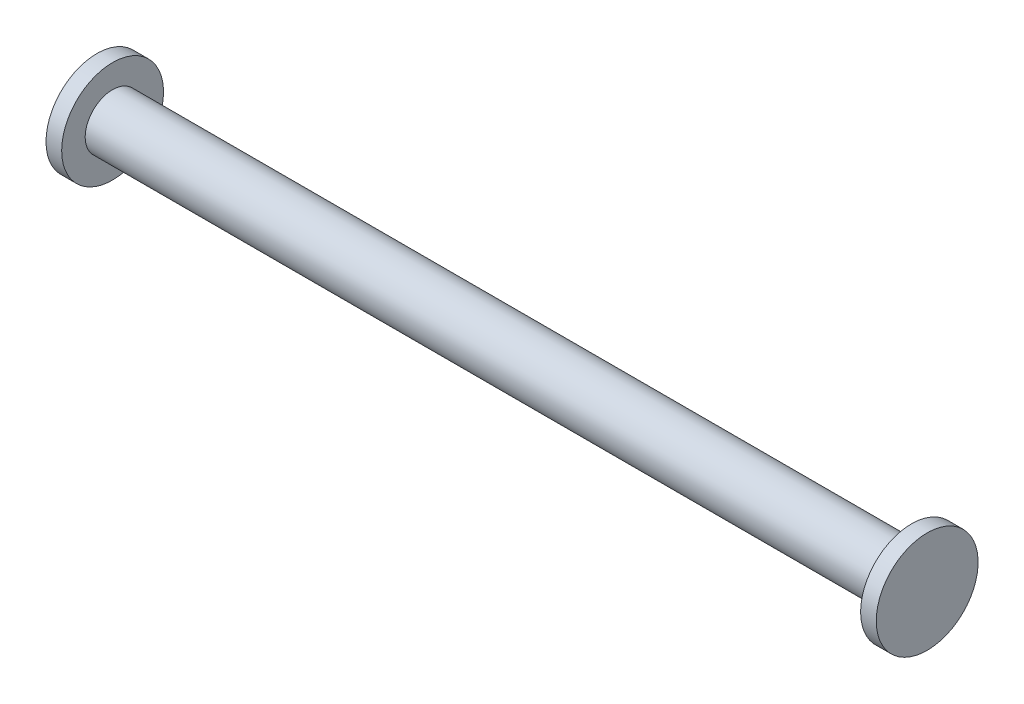
from build123d import *


with BuildPart() as part:
    # Sketch1 → Revolve1 (revolve)
    with BuildSketch(Plane(origin=(0, 0, 0), x_dir=(1, 0, 0), z_dir=(0, 1, 0)), mode=Mode.PRIVATE) as revolve1_sk:
        Polygon((53, 0), (53, 6.5), (51, 6.5), (51, 3.5), (-51, 3.5), (-51, 6.5), (-53, 6.5), (-53, 0), align=None)
    revolve(revolve1_sk.sketch.rotate(Axis((-53, 0, 0), (1, 0, 0)), 180), axis=Axis((-53, 0, 0), (1, 0, 0)))


solid = part.part
